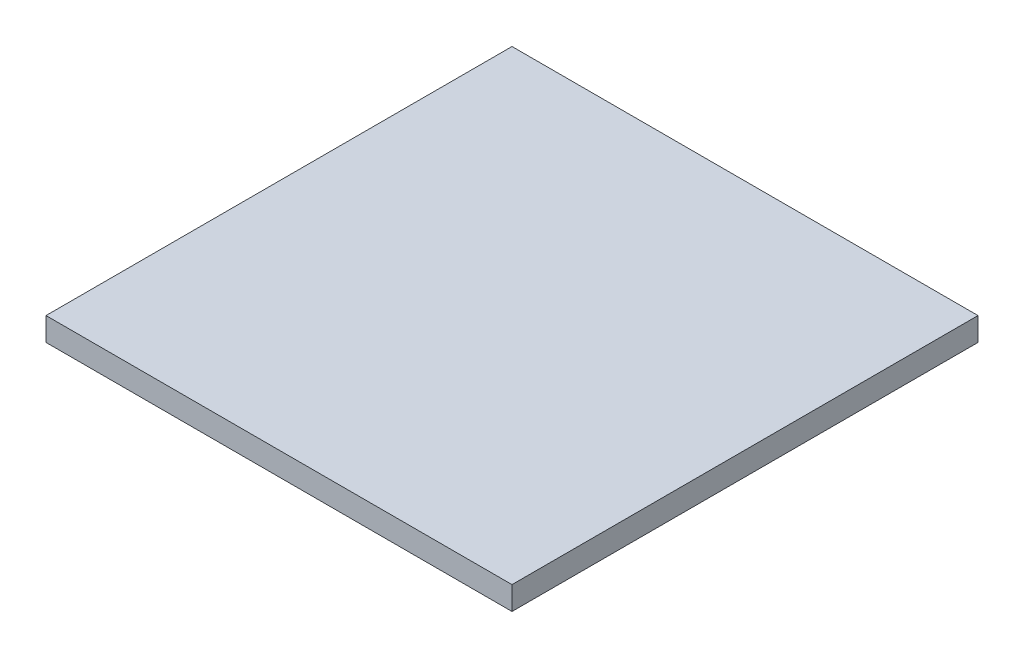
from build123d import *

# Parameters (mm, degrees)
SKETCH1_W           = 100
SKETCH1_H           = 100
BOSS_EXTRUDE1_DEPTH = 2.5


with BuildPart() as part:
    # Sketch1 → Boss-Extrude1 (new, symmetric)
    with BuildSketch(Plane(origin=(0, 0, 0), x_dir=(1, 0, 0), z_dir=(0, 1, 0))):
        Rectangle(SKETCH1_W, SKETCH1_H)
    extrude(amount=BOSS_EXTRUDE1_DEPTH, both=True)


solid = part.part
